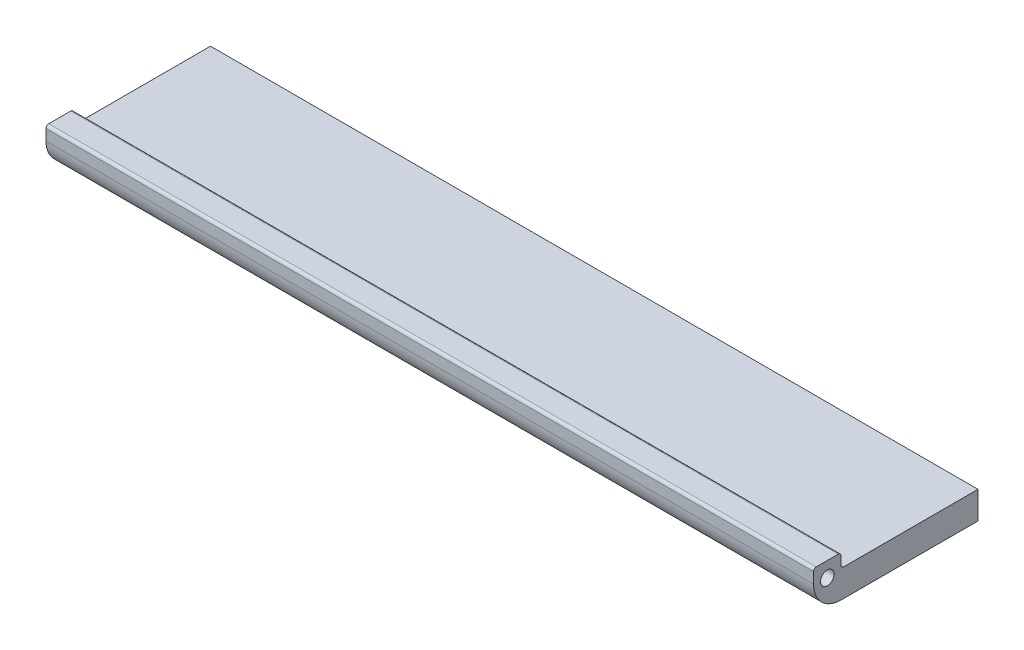
from build123d import *

# Parameters (mm, degrees)
SKETCH1_W           = 280
SKETCH1_H           = 60
BOSS_EXTRUDE1_DEPTH = 10
SKETCH2_W           = 280
SKETCH2_H           = 10
BOSS_EXTRUDE2_DEPTH = 5
SKETCH3_R           = 2.5
CUT_EXTRUDE1_DEPTH  = 287.749019179
FILLET1_R           = 10
FILLET2_R           = 1
FILLET3_R           = 1
FILLET4_R           = 1


with BuildPart() as part:
    # Sketch1 → Boss-Extrude1 (new body)
    with BuildSketch(Plane(origin=(0, 0, 0), x_dir=(1, 0, 0), z_dir=(0, 1, 0))):
        with Locations((0, -30)):
            Rectangle(SKETCH1_W, SKETCH1_H)
    extrude(amount=BOSS_EXTRUDE1_DEPTH)

    # Sketch2 → Boss-Extrude2 (add)
    with BuildSketch(Plane(origin=(0, 10, 0), x_dir=(1, 0, 0), z_dir=(0, 1, 0))):
        with Locations((0, -55)):
            Rectangle(SKETCH2_W, SKETCH2_H)
    extrude(amount=BOSS_EXTRUDE2_DEPTH)

    # Sketch3 → Cut-Extrude1 (cut, through all)
    with BuildSketch(Plane(origin=(140, 0, 0), x_dir=(0, 0, -1), z_dir=(1, 0, 0))):
        with Locations((-55, 9.5)):
            Circle(SKETCH3_R)
    extrude(amount=-CUT_EXTRUDE1_DEPTH, mode=Mode.SUBTRACT)

    # Fillet1
    fillet1_edges = [part.edges().sort_by_distance(p)[0] for p in [
        (0, 0, 60),
    ]]
    fillet(fillet1_edges, radius=FILLET1_R)

    # Fillet2
    fillet2_edges = [part.edges().sort_by_distance(p)[0] for p in [
        (0, 15, 60),
    ]]
    fillet(fillet2_edges, radius=FILLET2_R)

    # Fillet3
    fillet3_edges = [part.edges().sort_by_distance(p)[0] for p in [
        (0, 15, 50),
    ]]
    fillet(fillet3_edges, radius=FILLET3_R)

    # Fillet4
    fillet4_edges = [part.edges().sort_by_distance(p)[0] for p in [
        (0, 10, 50),
    ]]
    fillet(fillet4_edges, radius=FILLET4_R)


solid = part.part
